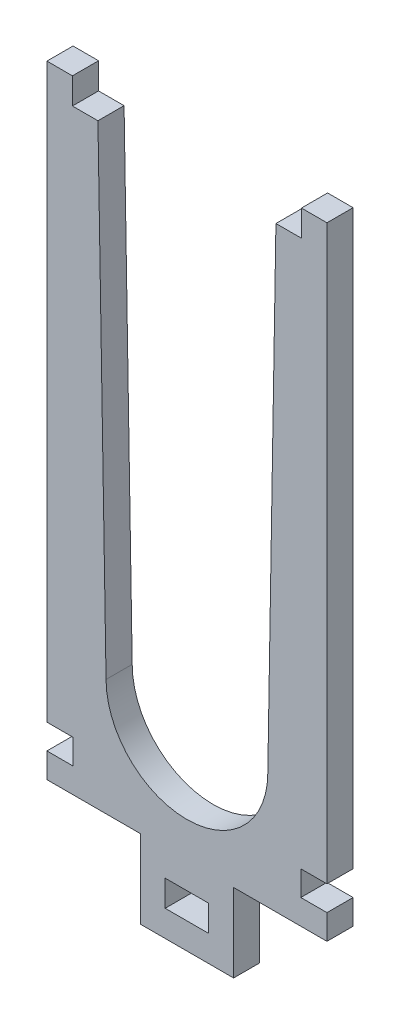
from build123d import *

# Parameters (mm, degrees)
SKETCH8_W           = 57.15
SKETCH8_H           = 127
BOSS_EXTRUDE3_DEPTH = 5.334
SKETCH9_R           = 16.505180298
CUT_EXTRUDE4_DEPTH  = 140.368483008
SKETCH12_W          = 19.05
SKETCH12_H          = 5.334
CUT_EXTRUDE8_DEPTH  = 5.334
SKETCH14_W          = 10.414
SKETCH14_H          = 5.334
BOSS_EXTRUDE4_DEPTH = 5.334
SKETCH15_W          = 5.207
SKETCH15_H          = 5.334
CUT_EXTRUDE9_DEPTH  = 5.334
SKETCH22_W          = 19.05
SKETCH22_H          = 5.334
BOSS_EXTRUDE5_DEPTH = 10.668
SKETCH23_W          = 8.89
SKETCH23_H          = 5.334
CUT_EXTRUDE15_DEPTH = 145.245837417
SKETCH24_W          = 5.334
SKETCH24_H          = 5.08
CUT_EXTRUDE16_DEPTH = 145.245837417


with BuildPart() as part:
    # Sketch8 → Boss-Extrude3 (new body)
    with BuildSketch(Plane.XY):
        with Locations((28.575, 63.5)):
            Rectangle(SKETCH8_W, SKETCH8_H)
    extrude(amount=BOSS_EXTRUDE3_DEPTH)

    # Sketch9 → Cut-Extrude4 (cut, through all)
    with BuildSketch(Plane.XY.offset(5.334)):
        with BuildLine():
            Line((46.736, 127), (10.414, 127))
            Line((10.414, 127), (12.069819702, 29.083))
            ThreePointArc((12.069819702, 29.083), (28.575, 45.588180298), (45.080180298, 29.083))
            Line((45.080180298, 29.083), (46.736, 127))
        make_face()
        with Locations((28.575, 29.083)):
            Circle(SKETCH9_R)
    extrude(amount=-CUT_EXTRUDE4_DEPTH, mode=Mode.SUBTRACT)

    # Sketch12 → Cut-Extrude8 (cut)
    with BuildSketch(Plane(origin=(0, 0, 0), x_dir=(-1, 0, 0), z_dir=(0, -1, 0))):
        with Locations((-47.625, -2.667)):
            Rectangle(SKETCH12_W, SKETCH12_H)
        with Locations((-9.525, -2.667)):
            Rectangle(SKETCH12_W, SKETCH12_H)
    extrude(amount=-CUT_EXTRUDE8_DEPTH, mode=Mode.SUBTRACT)

    # Sketch14 → Boss-Extrude4 (add)
    with BuildSketch(Plane(origin=(0, 127, 0), x_dir=(1, 0, 0), z_dir=(0, 1, 0))):
        with Locations((51.943, -2.667)):
            Rectangle(SKETCH14_W, SKETCH14_H)
        with Locations((5.207, -2.667)):
            Rectangle(SKETCH14_W, SKETCH14_H)
    extrude(amount=BOSS_EXTRUDE4_DEPTH)

    # Sketch15 → Cut-Extrude9 (cut)
    with BuildSketch(Plane(origin=(0, 132.334, 0), x_dir=(1, 0, 0), z_dir=(0, 1, 0))):
        with Locations((7.8105, -2.667)):
            Rectangle(SKETCH15_W, SKETCH15_H)
        with Locations((49.3395, -2.667)):
            Rectangle(SKETCH15_W, SKETCH15_H)
    extrude(amount=-CUT_EXTRUDE9_DEPTH, mode=Mode.SUBTRACT)

    # Sketch22 → Boss-Extrude5 (add)
    with BuildSketch(Plane.XZ):
        with Locations((28.575, 2.667)):
            Rectangle(SKETCH22_W, SKETCH22_H)
    extrude(amount=BOSS_EXTRUDE5_DEPTH)

    # Sketch23 → Cut-Extrude15 (cut, through all)
    with BuildSketch(Plane(origin=(0, 0, 0), x_dir=(-1, 0, 0), z_dir=(0, 0, -1))):
        with Locations((-28.575, -2.667)):
            Rectangle(SKETCH23_W, SKETCH23_H)
    extrude(amount=-CUT_EXTRUDE15_DEPTH, mode=Mode.SUBTRACT)

    # Sketch24 → Cut-Extrude16 (cut, through all)
    with BuildSketch(Plane(origin=(0, 0, 0), x_dir=(-1, 0, 0), z_dir=(0, 0, -1))):
        with Locations((-54.483, 12.954)):
            Rectangle(SKETCH24_W, SKETCH24_H)
        with Locations((-2.667, 12.954)):
            Rectangle(SKETCH24_W, SKETCH24_H)
    extrude(amount=-CUT_EXTRUDE16_DEPTH, mode=Mode.SUBTRACT)


solid = part.part
